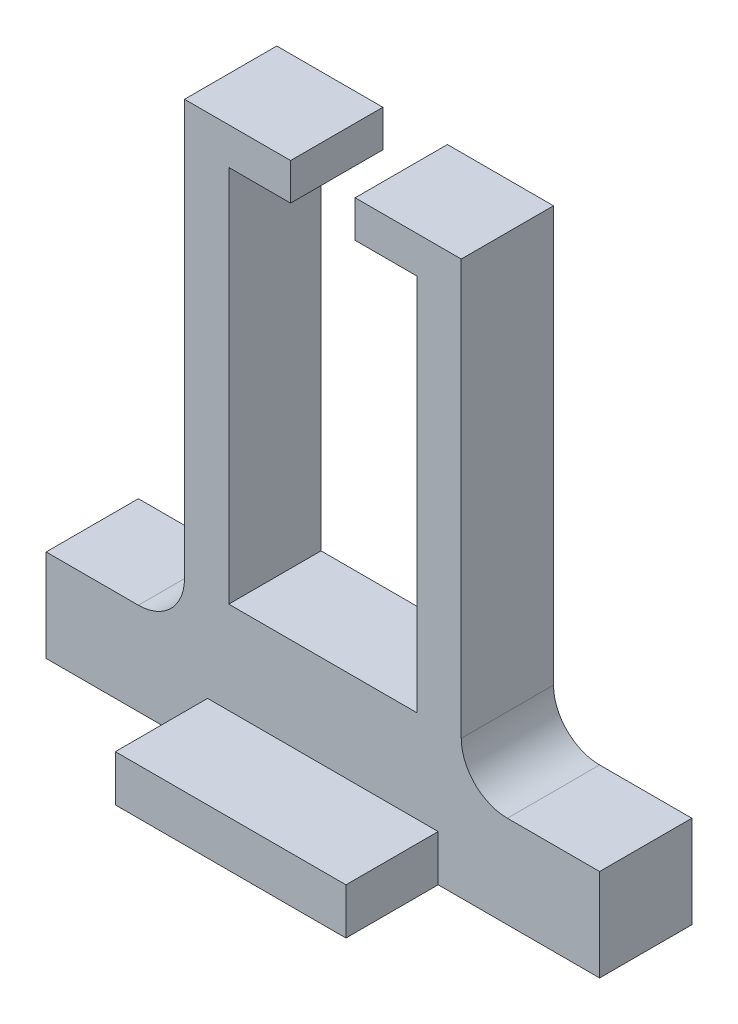
from build123d import *

# Parameters (mm, degrees)
SKETCH1_W           = 20.4
SKETCH1_H           = 41
BOSS_EXTRUDE1_DEPTH = 10
CUT_EXTRUDE1_REACH  = 69.823
SKETCH2_W           = 7
SKETCH2_H           = 10
SKETCH3_W           = 25
SKETCH3_H           = 5
BOSS_EXTRUDE2_DEPTH = 10


with BuildPart() as part:
    # Sketch1 → Boss-Extrude1 (new body)
    with BuildSketch(Plane.XY):
        with BuildLine():
            Line((-15, 24.5), (-15, -20.5))
            ThreePointArc((-15, -20.5), (-16.464466094, -24.035533906), (-20, -25.5))
            Line((-20, -25.5), (-30, -25.5))
            Line((-30, -25.5), (-30, -35.5))
            Line((-30, -35.5), (30, -35.5))
            Line((30, -35.5), (30, -25.5))
            Line((30, -25.5), (20, -25.5))
            ThreePointArc((20, -25.5), (16.464466094, -24.035533906), (15, -20.5))
            Line((15, -20.5), (15, 24.5))
            Line((15, 24.5), (-15, 24.5))
        make_face()
        Rectangle(SKETCH1_W, SKETCH1_H, mode=Mode.SUBTRACT)
    extrude(amount=BOSS_EXTRUDE1_DEPTH)

    # Sketch2 → Cut-Extrude1 (cut, up to next)
    with BuildSketch(Plane(origin=(0, 24.5, 0), x_dir=(1, 0, 0), z_dir=(0, 1, 0)), mode=Mode.PRIVATE) as cut_extrude1_sk1:
        with Locations((0, -5)):
            Rectangle(SKETCH2_W, SKETCH2_H)
    cut_extrude1_tool1 = extrude(cut_extrude1_sk1.sketch, amount=-CUT_EXTRUDE1_REACH, mode=Mode.PRIVATE) & part.part
    add(cut_extrude1_tool1.solids().sort_by_distance((0, 24.5, 5))[0], mode=Mode.SUBTRACT)

    # Sketch3 → Boss-Extrude2 (add)
    with BuildSketch(Plane.XY.offset(10)):
        with Locations((0, -33)):
            Rectangle(SKETCH3_W, SKETCH3_H)
    extrude(amount=BOSS_EXTRUDE2_DEPTH)


solid = part.part
